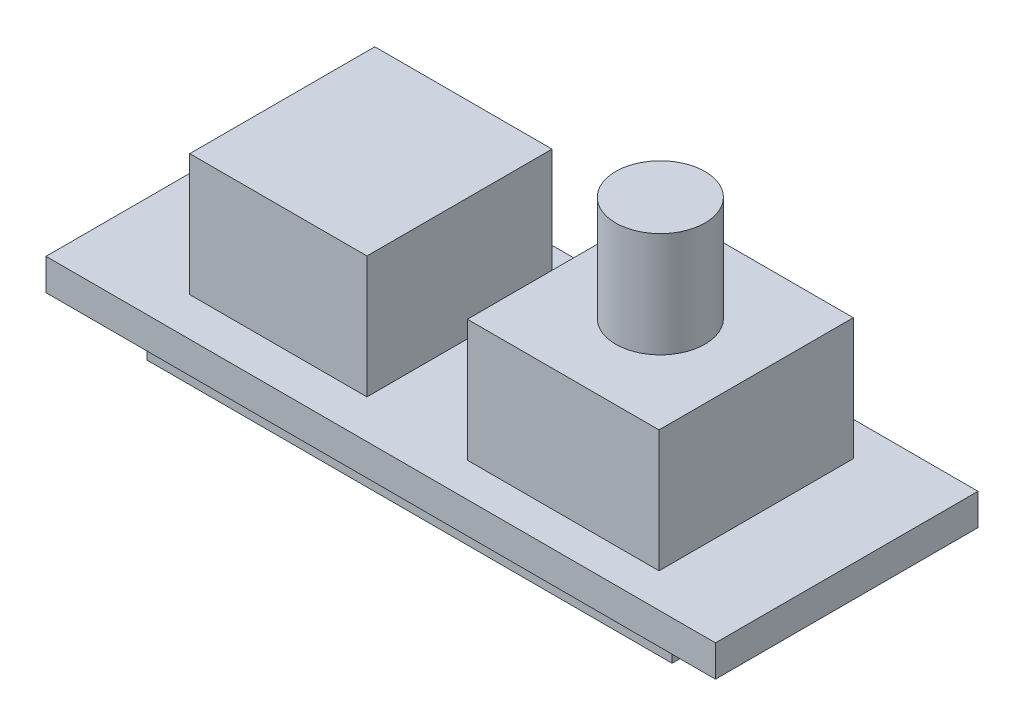
from build123d import *

# Parameters (mm, degrees)
SKETCH2_W           = 25.5
SKETCH2_H           = 10
BOSS_EXTRUDE1_DEPTH = 1.2
SKETCH4_W           = 6.75
SKETCH4_H           = 7.05
SKETCH4_W_2         = 7.3
SKETCH4_H_2         = 7.4
BOSS_EXTRUDE2_DEPTH = 4.65
SKETCH5_R           = 1.7
BOSS_EXTRUDE3_DEPTH = 4
SKETCH6_W           = 20
SKETCH6_H           = 7.8
BOSS_EXTRUDE4_DEPTH = 1.4


with BuildPart() as part:
    # Sketch2 → Boss-Extrude1 (new body)
    with BuildSketch(Plane(origin=(0, 0, 0), x_dir=(1, 0, 0), z_dir=(0, 1, 0))):
        Rectangle(SKETCH2_W, SKETCH2_H)
    extrude(amount=BOSS_EXTRUDE1_DEPTH)

    # Sketch4 → Boss-Extrude2 (add)
    with BuildSketch(Plane(origin=(0, 1.2, 0), x_dir=(1, 0, 0), z_dir=(0, 1, 0))):
        with Locations((-5.375, 0)):
            Rectangle(SKETCH4_W, SKETCH4_H)
        with Locations((5.65, 0)):
            Rectangle(SKETCH4_W_2, SKETCH4_H_2)
    extrude(amount=BOSS_EXTRUDE2_DEPTH)

    # Sketch5 → Boss-Extrude3 (add)
    with BuildSketch(Plane(origin=(0, 5.85, 0), x_dir=(1, 0, 0), z_dir=(0, 1, 0))):
        with Locations(Location((5.65, 0, 0), (0, 0, 270))):
            Circle(SKETCH5_R)
    extrude(amount=BOSS_EXTRUDE3_DEPTH)

    # Sketch6 → Boss-Extrude4 (add)
    with BuildSketch(Plane.XZ):
        Rectangle(SKETCH6_W, SKETCH6_H)
    extrude(amount=BOSS_EXTRUDE4_DEPTH)


solid = part.part
